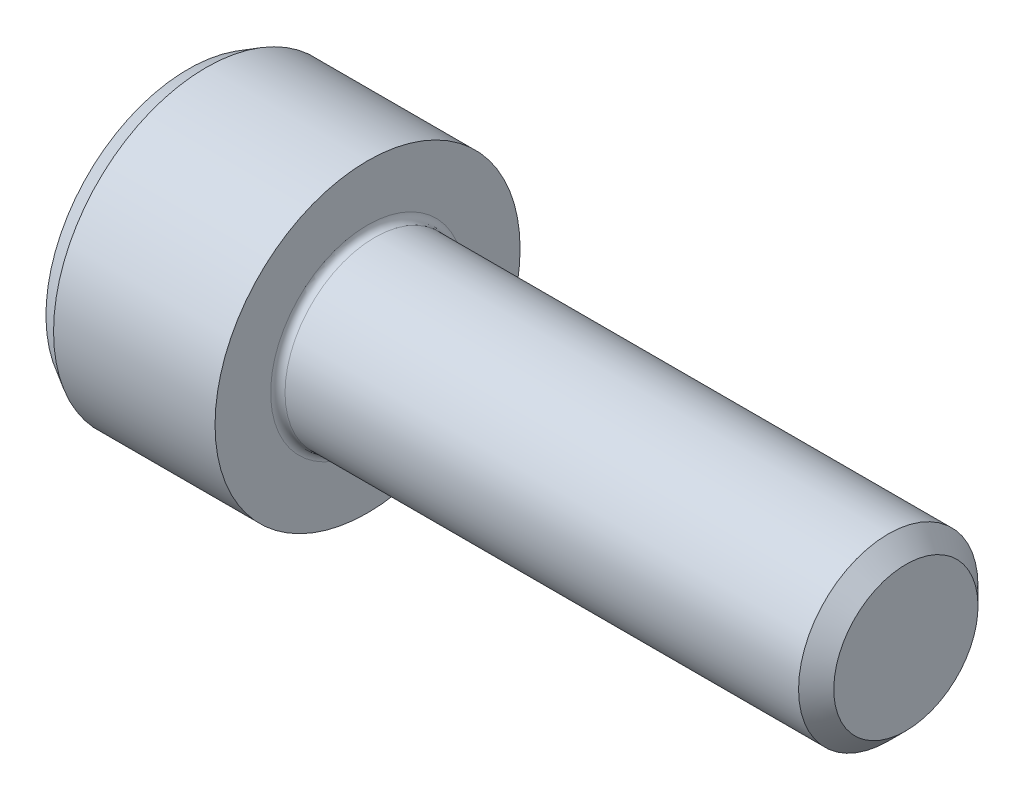
from build123d import *

# Parameters (mm, degrees)
CUT_EXTRUDE_1_DEPTH = 2.5


with BuildPart() as part:
    # 草图1 → 旋转1 (revolve)
    with BuildSketch(Plane.XY):
        with BuildLine():
            Line((-5, 0), (-5, 3.961324865))
            Line((-5, 3.961324865), (-4.5, 4.25))
            Line((-4.5, 4.25), (0, 4.25))
            Line((0, 4.25), (0, 2.7))
            ThreePointArc((0, 2.7), (0.058578644, 2.558578644), (0.2, 2.5))
            Line((0.2, 2.5), (14.5095, 2.5))
            Line((14.5095, 2.5), (15, 2.0095))
            Line((15, 2.0095), (15, 0))
            Line((15, 0), (-5, 0))
        make_face()
    revolve(axis=Axis((15, 0, 0), (-1, 0, 0)))

    # 草图2 → 切除-旋转1 (revolve, cut)
    with BuildSketch(Plane.XY):
        Polygon((-5, 0), (-5, 2), (-2.5, 2), (-1.345299462, 0), align=None)
    revolve(axis=Axis((-1.345299462, 0, 0), (-1, 0, 0)), mode=Mode.SUBTRACT)

    # 草图3 → 切除-拉伸1 (cut)
    with BuildSketch(Plane(origin=(-5, 0, 0), x_dir=(0, 0, -1), z_dir=(1, 0, 0))):
        Polygon((-2, -1.154700538), (0, -2.309401077), (2, -1.154700538), (2, 1.154700538), (0, 2.309401077), (-2, 1.154700538), align=None)
    extrude(amount=CUT_EXTRUDE_1_DEPTH, mode=Mode.SUBTRACT)


solid = part.part
